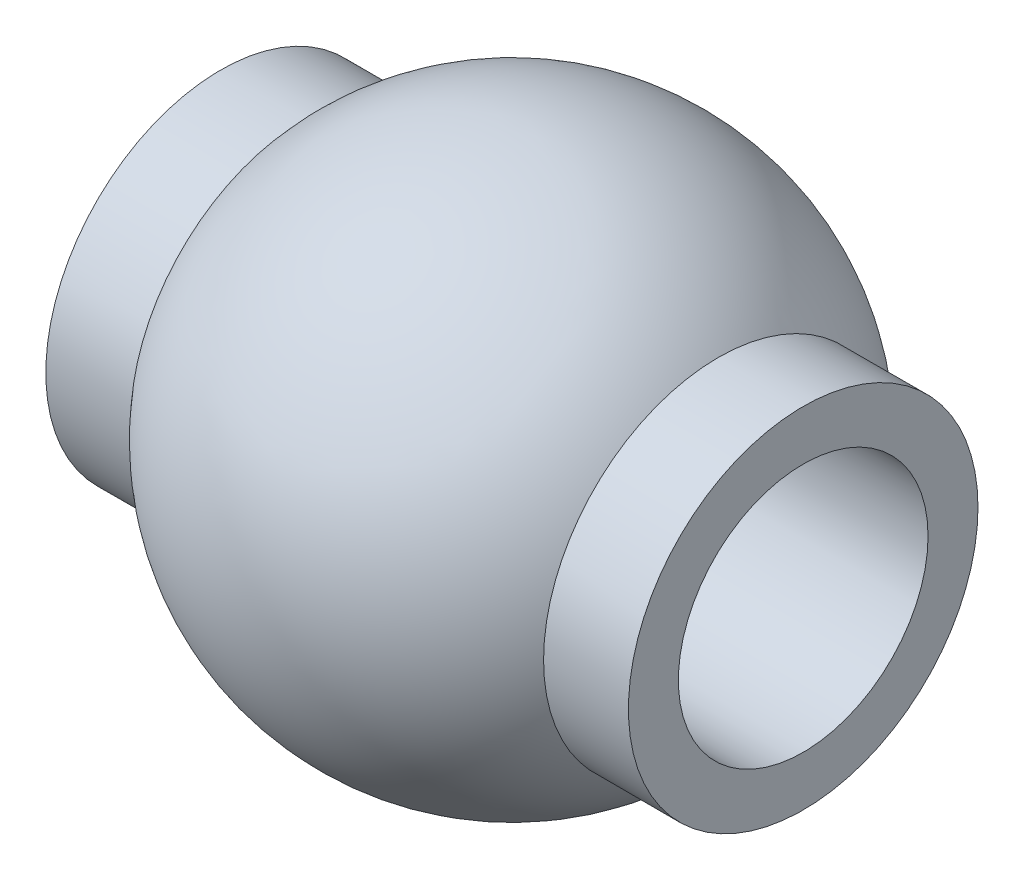
from build123d import *

# Parameters (mm, degrees)
BOSS_EXTRUDE1_DEPTH      = 11.1125
BOSS_EXTRUDE1_DEPTH_BACK = 11.1125
SKETCH3_R                = 6.6675
SKETCH3_R_2              = 4.7625
SKETCH4_R                = 4.7625
CUT_EXTRUDE1_DEPTH       = 27.587663165


with BuildPart() as part:
    # Sketch2 → Revolve1 (revolve)
    with BuildSketch(Plane(origin=(0, 0, 0), x_dir=(1, 0, 0), z_dir=(0, 1, 0))):
        with BuildLine():
            Line((0, 10.31875), (0, -10.31875))
            ThreePointArc((0, -10.31875), (10.31875, 0), (0, 10.31875))
        make_face()
    revolve(axis=Axis((0, 0, -10.31875), (0, 0, 1)))

    # Sketch3 → Boss-Extrude1 (add, two sides: drawn at the far end of the back side and taken through both)
    with BuildSketch(Plane(origin=(0, 0, 0), x_dir=(0, 0, -1), z_dir=(1, 0, 0)).offset(-BOSS_EXTRUDE1_DEPTH_BACK)):
        Circle(SKETCH3_R)
        Circle(SKETCH3_R_2, mode=Mode.SUBTRACT)
    extrude(amount=BOSS_EXTRUDE1_DEPTH + BOSS_EXTRUDE1_DEPTH_BACK)

    # Sketch4 → Cut-Extrude1 (cut, through all)
    with BuildSketch(Plane(origin=(11.1125, 0, 0), x_dir=(0, 0, -1), z_dir=(1, 0, 0))):
        Circle(SKETCH4_R)
    extrude(amount=-CUT_EXTRUDE1_DEPTH, mode=Mode.SUBTRACT)


solid = part.part
